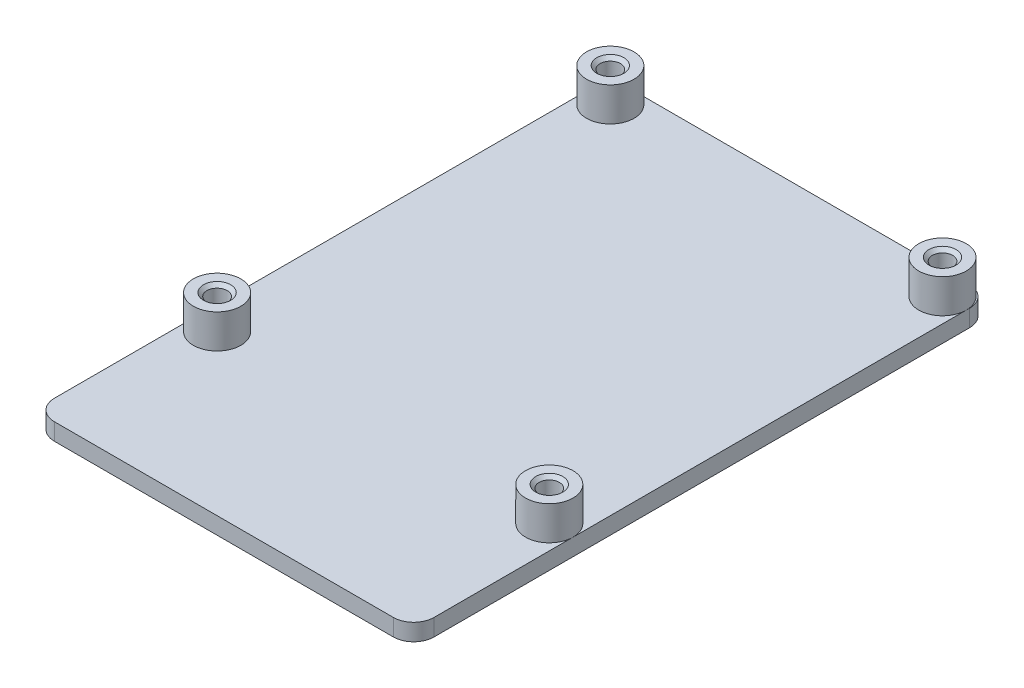
from build123d import *

# Parameters (mm, degrees)
BOSS_EXTRUDE1_DEPTH = 2.5
SKETCH3_R           = 3.5
SKETCH3_R_2         = 1.5
BOSS_EXTRUDE2_DEPTH = 5
CHAMFER1_SIZE       = 0.5


with BuildPart() as part:
    # Sketch2 → Boss-Extrude1 (new body)
    with BuildSketch(Plane(origin=(0, 0, 0), x_dir=(1, 0, 0), z_dir=(0, 1, 0))):
        with BuildLine():
            Line((-68, 85.95), (-68, 6.95))
            ThreePointArc((-68, 6.95), (-67.121320344, 4.828679656), (-65, 3.95))
            Line((-65, 3.95), (-15, 3.95))
            ThreePointArc((-15, 3.95), (-12.878679656, 4.828679656), (-12, 6.95))
            Line((-12, 6.95), (-12, 85.95))
            ThreePointArc((-12, 85.95), (-12.878679656, 88.071320344), (-15, 88.95))
            Line((-15, 88.95), (-65, 88.95))
            ThreePointArc((-65, 88.95), (-67.121320344, 88.071320344), (-68, 85.95))
        make_face()
    extrude(amount=BOSS_EXTRUDE1_DEPTH)

    # Sketch3 → Boss-Extrude2 (add)
    # profile 1 of 4: a face of its own
    with BuildSketch(Plane(origin=(0, 2.5, 0), x_dir=(1, 0, 0), z_dir=(0, 1, 0))):
        with Locations((-64.5, 85.45)):
            Circle(SKETCH3_R)
        with Locations((-64.5, 85.45)):
            Circle(SKETCH3_R_2, mode=Mode.SUBTRACT)
    # profile 2 of 4: a face of its own
    with BuildSketch(Plane(origin=(0, 2.5, 0), x_dir=(1, 0, 0), z_dir=(0, 1, 0))):
        with Locations((-15.5, 85.45)):
            Circle(SKETCH3_R)
        with Locations((-15.5, 85.45)):
            Circle(SKETCH3_R_2, mode=Mode.SUBTRACT)
    # profile 3 of 4: a face of its own
    with BuildSketch(Plane(origin=(0, 2.5, 0), x_dir=(1, 0, 0), z_dir=(0, 1, 0))):
        with Locations((-15.5, 27.45)):
            Circle(SKETCH3_R)
        with Locations((-15.5, 27.45)):
            Circle(SKETCH3_R_2, mode=Mode.SUBTRACT)
    # profile 4 of 4: a face of its own
    with BuildSketch(Plane(origin=(0, 2.5, 0), x_dir=(1, 0, 0), z_dir=(0, 1, 0))):
        with Locations((-64.5, 27.45)):
            Circle(SKETCH3_R)
        with Locations((-64.5, 27.45)):
            Circle(SKETCH3_R_2, mode=Mode.SUBTRACT)
    extrude(amount=BOSS_EXTRUDE2_DEPTH)

    # Chamfer1
    chamfer1_edges = [part.edges().sort_by_distance(p)[0] for p in [
        (-66, 7.5, -27.45),
        (-17, 7.5, -27.45),
        (-17, 7.5, -85.45),
        (-66, 7.5, -85.45),
    ]]
    chamfer(chamfer1_edges, length=CHAMFER1_SIZE)


solid = part.part
